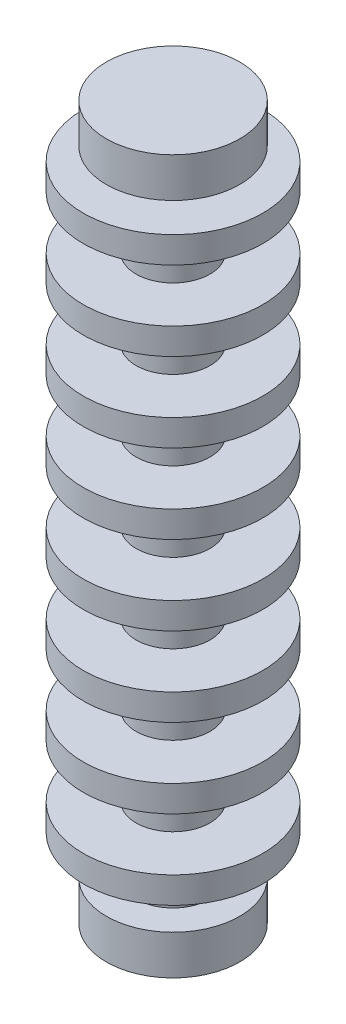
from build123d import *


with BuildPart() as part:
    # Sketch1 → Revolve1 (revolve)
    with BuildSketch(Plane.XY, mode=Mode.PRIVATE) as revolve1_sk:
        Polygon((2.8, 24), (2.8, 23), (6.8, 23), (6.8, 21), (2.8, 21), (2.8, 18), (2.8, 17), (6.8, 17), (6.8, 15), (2.8, 15), (2.8, 12), (2.8, 11), (6.8, 11), (6.8, 9), (2.8, 9), (2.8, 6), (2.8, 5), (6.8, 5), (6.8, 3), (2.8, 3), (2.8, 0), (2.8, -1), (6.8, -1), (6.8, -3), (2.8, -3), (2.8, -6), (2.8, -7), (6.8, -7), (6.8, -9), (2.8, -9), (2.8, -12), (2.8, -13), (6.8, -13), (6.8, -15), (2.8, -15), (2.8, -18), (2.8, -19), (6.8, -19), (6.8, -21), (2.8, -21), (2.8, -24), (5.05, -24), (5.05, -27), (0, -27), (0, 27), (5.05, 27), (5.05, 24), align=None)
    revolve(revolve1_sk.sketch.rotate(Axis((0, 27, 0), (0, -1, 0)), 180), axis=Axis((0, 27, 0), (0, -1, 0)))


solid = part.part
